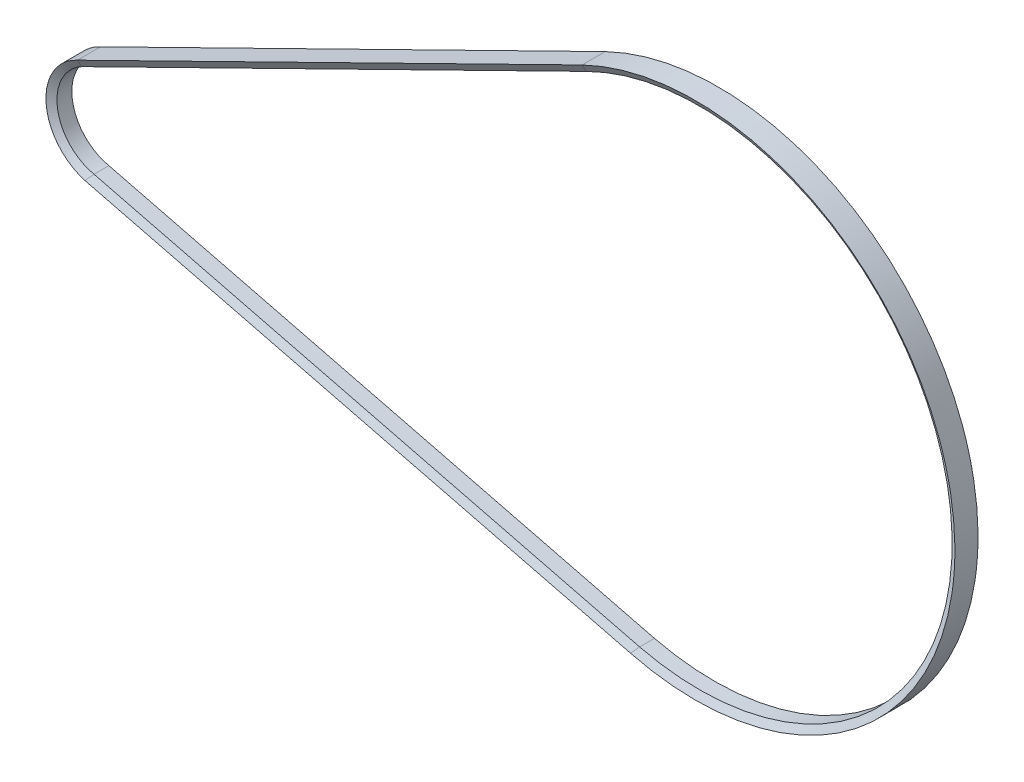
from build123d import *


with BuildPart() as part:
    # Barrer1: sweep along a path in Croquis2
    with BuildLine(Plane.XY) as barrer1_path:
        Line((-37.642747593, -150.359647358), (-367.653121399, -67.741089637))
        ThreePointArc((-367.653121399, -67.741089637), (-390.469979201, -41.498544198), (-373.678535591, -11.046489873))
        Line((-373.678535591, -11.046489873), (-68.404908321, 139.089066852))
        ThreePointArc((-68.404908321, 139.089066852), (154.131975497, 16.380907466), (-37.642747593, -150.359647358))
    # Croquis3 → Barrer1 (sweep)
    with BuildSketch(Plane(origin=(-68.404908321, 0, 0), x_dir=(0, 0, -1), z_dir=(1, 0, 0))):
        Polygon((-4.5, 136.769066852), (4.5, 136.769066852), (7, 141.409066852), (-7, 141.409066852), align=None)
    sweep(path=barrer1_path.line)


solid = part.part
